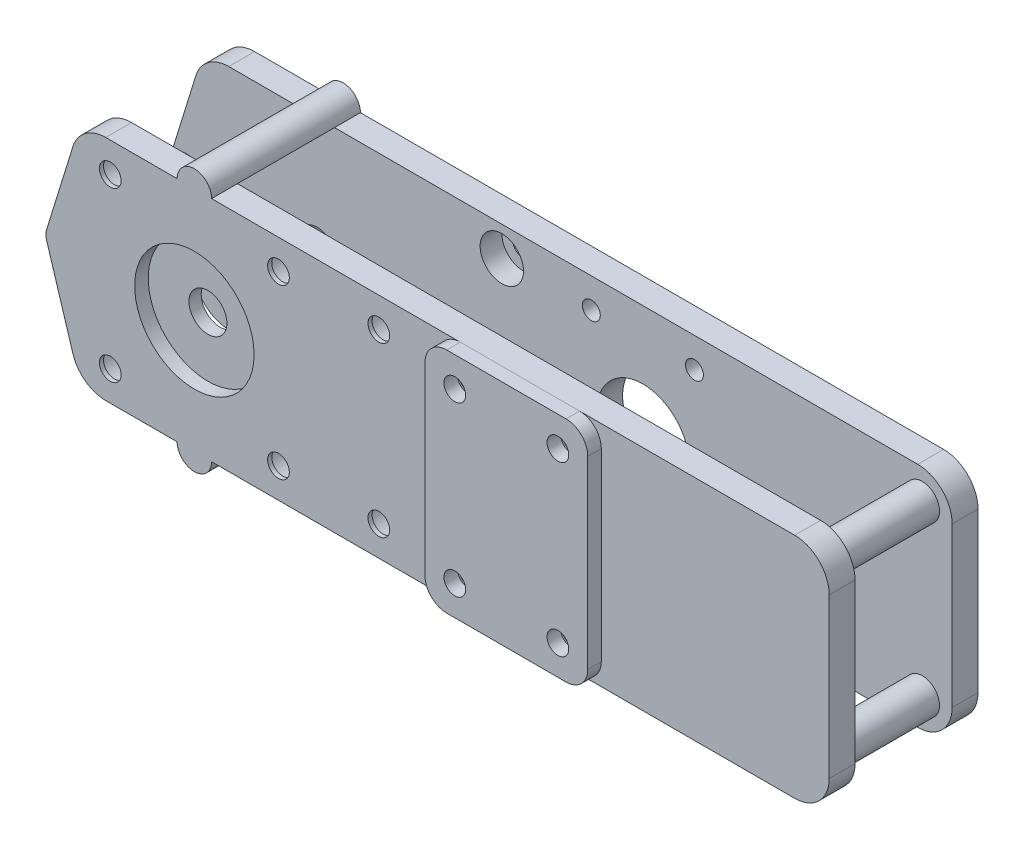
from build123d import *

# Parameters (mm, degrees)
SKETCH2_W               = 138
SKETCH2_H               = 42
SKETCH2_R               = 2
SKETCH2_R_2             = 3.5
SKETCH2_R_3             = 8.5
BOSS_EXTRUDE1_DEPTH     = 2.38125
SKETCH3_R               = 4
SKETCH3_R_2             = 2
CUT_EXTRUDE1_DEPTH      = 4
SKETCH4_R               = 3.175
SKETCH4_R_2             = 2
BOSS_EXTRUDE2_DEPTH     = 17.9
SKETCH6_R               = 2
CUT_EXTRUDE2_DEPTH      = 10
BOSS_EXTRUDE3_DEPTH     = 4.7625
SKETCH7_R               = 3.175
BOSS_EXTRUDE4_DEPTH     = 17.9
FILLET1_R               = 6.35
BOSS_EXTRUDE5_REACH     = 123.992
CUT_EXTRUDE4_START      = -4
SKETCH9_R               = 4
CUT_EXTRUDE4_DEPTH      = 4
SKETCH10_R              = 11.00455
CUT_EXTRUDE5_DEPTH      = 2.5
CUT_EXTRUDE6_DEPTH      = 123.578796086
CUT_EXTRUDE6_DEPTH_BACK = 123.578796086
SKETCH11_R              = 1.65
SKETCH12_R              = 2
BOSS_EXTRUDE6_DEPTH     = 2.5


with BuildPart() as part:
    # Sketch2 → Boss-Extrude1 (new, symmetric)
    with BuildSketch(Plane.XY):
        with Locations((48, 0)):
            Rectangle(SKETCH2_W, SKETCH2_H)
        with Locations(Location((34, -15.5, 0), (0, 0, 180))):
            Circle(SKETCH2_R, mode=Mode.SUBTRACT)
        with Locations(Location((34, 15.5, 0), (0, 0, 180))):
            Circle(SKETCH2_R, mode=Mode.SUBTRACT)
        with Locations(Location((0, 0, 0), (0, 0, 180))):
            Circle(SKETCH2_R_2, mode=Mode.SUBTRACT)
        with Locations(Location((60, 0, 0), (0, 0, 180))):
            Circle(SKETCH2_R_3, mode=Mode.SUBTRACT)
    boss_extrude1 = extrude(amount=BOSS_EXTRUDE1_DEPTH, both=True)

    # Sketch3 → Cut-Extrude1 (cut)
    # profile 1 of 6: a face of its own
    with BuildSketch(Plane(origin=(0, 0, -2.38125), x_dir=(-1, 0, 0), z_dir=(0, 0, -1))):
        with Locations((-34, -15.5)):
            Circle(SKETCH3_R)
    # profile 2 of 6: a face of its own
    with BuildSketch(Plane(origin=(0, 0, -2.38125), x_dir=(-1, 0, 0), z_dir=(0, 0, -1))):
        with Locations((-34, 15.5)):
            Circle(SKETCH3_R)
        with Locations((-34, 15.5)):
            Circle(SKETCH3_R_2, mode=Mode.SUBTRACT)
    # profile 3 of 6: a face of its own
    with BuildSketch(Plane(origin=(0, 0, -2.38125), x_dir=(-1, 0, 0), z_dir=(0, 0, -1))):
        with Locations((-15.5, 15.5)):
            Circle(SKETCH3_R)
    # profile 4 of 6: a face of its own
    with BuildSketch(Plane(origin=(0, 0, -2.38125), x_dir=(-1, 0, 0), z_dir=(0, 0, -1))):
        with Locations((15.5, 15.5)):
            Circle(SKETCH3_R)
    # profile 5 of 6: a face of its own
    with BuildSketch(Plane(origin=(0, 0, -2.38125), x_dir=(-1, 0, 0), z_dir=(0, 0, -1))):
        with Locations((-15.5, -15.5)):
            Circle(SKETCH3_R)
    # profile 6 of 6: a face of its own
    with BuildSketch(Plane(origin=(0, 0, -2.38125), x_dir=(-1, 0, 0), z_dir=(0, 0, -1))):
        with Locations((15.5, -15.5)):
            Circle(SKETCH3_R)
    extrude(amount=-CUT_EXTRUDE1_DEPTH, mode=Mode.SUBTRACT)

    # Sketch4 → Boss-Extrude2 (add)
    # profile 1 of 2: a face of its own
    with BuildSketch(Plane(origin=(0, 0, -2.38125), x_dir=(-1, 0, 0), z_dir=(0, 0, -1))):
        with Locations(Location((-111.5, -15.5, 0), (0, 0, 180))):
            Circle(SKETCH4_R)
        with Locations(Location((-111.5, -15.5, 0), (0, 0, 180))):
            Circle(SKETCH4_R_2, mode=Mode.SUBTRACT)
    # profile 2 of 2: a face of its own
    with BuildSketch(Plane(origin=(0, 0, -2.38125), x_dir=(-1, 0, 0), z_dir=(0, 0, -1))):
        with Locations(Location((-111.5, 15.5, 0), (0, 0, 180))):
            Circle(SKETCH4_R)
        with Locations(Location((-111.5, 15.5, 0), (0, 0, 180))):
            Circle(SKETCH4_R_2, mode=Mode.SUBTRACT)
    extrude(amount=BOSS_EXTRUDE2_DEPTH)

    # Sketch6 → Cut-Extrude2 (cut)
    with BuildSketch(Plane(origin=(0, 0, -2.38125), x_dir=(-1, 0, 0), z_dir=(0, 0, -1))):
        with Locations((-15.5, 15.5)):
            Circle(SKETCH6_R)
        with Locations((15.5, 15.5)):
            Circle(SKETCH6_R)
        with Locations((15.5, -15.5)):
            Circle(SKETCH6_R)
        with Locations((-15.5, -15.5)):
            Circle(SKETCH6_R)
    extrude(amount=-CUT_EXTRUDE2_DEPTH, mode=Mode.SUBTRACT)

    # Sketch5 → Boss-Extrude3 (add)
    with BuildSketch(Plane(origin=(0, 0, -2.38125), x_dir=(-1, 0, 0), z_dir=(0, 0, -1))):
        with BuildLine():
            Line((21, -21), (27.208091957, -0.938604379))
            ThreePointArc((27.208091957, -0.938604379), (27.35, 0), (27.208091957, 0.938604379))
            Line((27.208091957, 0.938604379), (21, 21))
            Line((21, 21), (21, -21))
        make_face()
    boss_extrude3 = extrude(amount=-BOSS_EXTRUDE3_DEPTH)

    # Mirror2: Boss-Extrude1, Boss-Extrude3 across plane
    add(boss_extrude1.mirror(Plane(origin=(0, 0, -11.33125), x_dir=(1, 0, 0), z_dir=(0, 0, -1))))
    add(boss_extrude3.mirror(Plane(origin=(0, 0, -11.33125), x_dir=(1, 0, 0), z_dir=(0, 0, -1))))

    # Sketch7 → Boss-Extrude4 (add)
    with BuildSketch(Plane.XY.offset(-20.28125)):
        with Locations(Location((-24.175, 0, 0), (0, 0, 197.194924512))):
            Circle(SKETCH7_R)
    extrude(amount=BOSS_EXTRUDE4_DEPTH)

    # Fillet1
    fillet1_edges = [part.edges().sort_by_distance(p)[0] for p in [
        (117, 21, -22.6625),
        (117, -21, -22.6625),
        (-21, -21, -22.6625),
        (-21, 21, -22.6625),
        (117, -21, 0),
        (-21, -21, 0),
        (-21, 21, 0),
        (117, 21, 0),
    ]]
    fillet(fillet1_edges, radius=FILLET1_R)

    # Boss-Extrude5: up to this face of the body (flat: up to its plane)
    boss_extrude5_end = Plane(part.part.faces().sort_by_distance((46.486388536, 0, 2.38125))[0])
    # Sketch8 → Boss-Extrude5 (add, up to the picked face)
    with BuildSketch(Plane(origin=(0, 0, -25.04375), x_dir=(-1, 0, 0), z_dir=(0, 0, -1)), mode=Mode.PRIVATE) as boss_extrude5_sk1:
        with BuildLine():
            ThreePointArc((3.175, 21), (0, 24.175), (-3.175, 21))
            Line((-3.175, 21), (3.175, 21))
        make_face()
    boss_extrude5_tool1 = split(extrude(boss_extrude5_sk1.sketch, amount=-BOSS_EXTRUDE5_REACH, mode=Mode.PRIVATE), bisect_by=boss_extrude5_end, keep=Keep.BOTH, mode=Mode.PRIVATE)
    # Sketch8 → Boss-Extrude5 (add, up to the picked face)
    with BuildSketch(Plane(origin=(0, 0, -25.04375), x_dir=(-1, 0, 0), z_dir=(0, 0, -1)), mode=Mode.PRIVATE) as boss_extrude5_sk2:
        with BuildLine():
            Line((3.175, -21), (-3.175, -21))
            ThreePointArc((-3.175, -21), (0, -24.175), (3.175, -21))
        make_face()
    boss_extrude5_tool2 = split(extrude(boss_extrude5_sk2.sketch, amount=-BOSS_EXTRUDE5_REACH, mode=Mode.PRIVATE), bisect_by=boss_extrude5_end, keep=Keep.BOTH, mode=Mode.PRIVATE)
    add(boss_extrude5_tool1.solids().sort_by(Axis((0, 22.347512, -25.04375), (0, 0, 1)))[0])
    add(boss_extrude5_tool2.solids().sort_by(Axis((0, -22.347512, -25.04375), (0, 0, 1)))[0])

    # Sketch9 → Cut-Extrude4 (cut)
    with BuildSketch(Plane.XY.offset(-20.28125).offset(CUT_EXTRUDE4_START)):
        with Locations(Location((34, -15.5, 0), (0, 0, 180))):
            Circle(SKETCH9_R)
        with Locations(Location((34, 15.5, 0), (0, 0, 180))):
            Circle(SKETCH9_R)
    extrude(amount=CUT_EXTRUDE4_DEPTH, mode=Mode.SUBTRACT)

    # Sketch10 → Cut-Extrude5 (cut)
    with BuildSketch(Plane.XY.offset(2.38125)):
        Circle(SKETCH10_R)
    extrude(amount=-CUT_EXTRUDE5_DEPTH, mode=Mode.SUBTRACT)

    # Sketch11 → Cut-Extrude6 (cut, two sides: drawn at the far end of the back side and taken through both)
    with BuildSketch(Plane.XY.offset(2.38125).offset(-CUT_EXTRUDE6_DEPTH_BACK)):
        with Locations((50.5, 15.5)):
            Circle(SKETCH11_R)
        with Locations(Location((69.5, 15.5, 0), (0, 0, 180))):
            Circle(SKETCH11_R)
        with Locations((69.5, -15.5)):
            Circle(SKETCH11_R)
        with Locations(Location((50.5, -15.5, 0), (0, 0, 180))):
            Circle(SKETCH11_R)
    extrude(amount=CUT_EXTRUDE6_DEPTH + CUT_EXTRUDE6_DEPTH_BACK, mode=Mode.SUBTRACT)


with BuildPart() as body_2:
    # Sketch12 → Boss-Extrude6 (new body)
    with BuildSketch(Plane.XY.offset(2.38125)):
        with BuildLine():
            Line((49, 21), (71, 21))
            ThreePointArc((71, 21), (73.828427125, 19.828427125), (75, 17))
            Line((75, 17), (75, -17))
            ThreePointArc((75, -17), (73.828427125, -19.828427125), (71, -21))
            Line((71, -21), (49, -21))
            ThreePointArc((49, -21), (46.171572875, -19.828427125), (45, -17))
            Line((45, -17), (45, 17))
            ThreePointArc((45, 17), (46.171572875, 19.828427125), (49, 21))
        make_face()
        with Locations((50.5, 15.5)):
            Circle(SKETCH12_R, mode=Mode.SUBTRACT)
        with Locations(Location((69.5, 15.5, 0), (0, 0, 180))):
            Circle(SKETCH12_R, mode=Mode.SUBTRACT)
        with Locations((69.5, -15.5)):
            Circle(SKETCH12_R, mode=Mode.SUBTRACT)
        with Locations(Location((50.5, -15.5, 0), (0, 0, 180))):
            Circle(SKETCH12_R, mode=Mode.SUBTRACT)
    extrude(amount=BOSS_EXTRUDE6_DEPTH)


solid = Compound([part.part, body_2.part])
